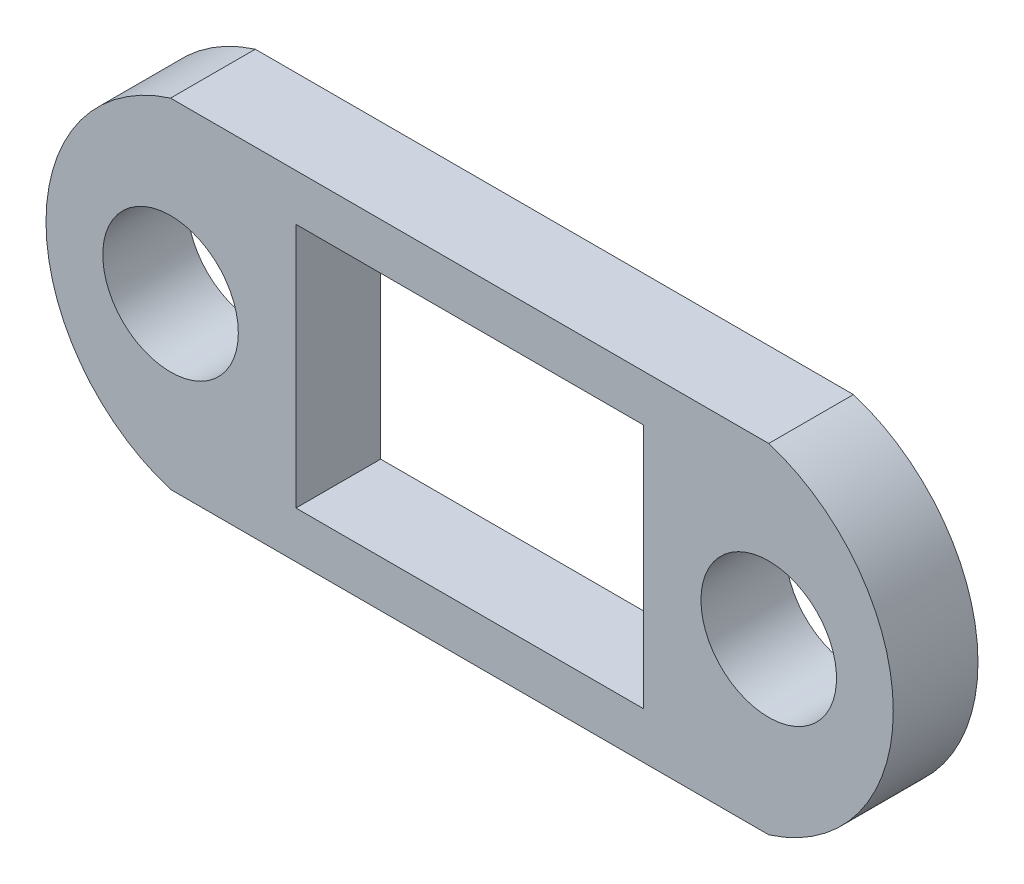
from build123d import *

# Parameters (mm, degrees)
SKETCH2_R           = 2
BOSS_EXTRUDE1_DEPTH = 2.5


with BuildPart() as part:
    # Sketch2 → Boss-Extrude1 (new body)
    with BuildSketch(Plane.XY):
        with BuildLine():
            Line((-8.825, 5.0000164), (8.825, 5.0000164))
            ThreePointArc((8.825, 5.0000164), (12.499924895, -2.3221e-05), (8.825, -5.000062843))
            Line((8.825, -5.000062843), (-8.825, -5.000062843))
            ThreePointArc((-8.825, -5.000062843), (-12.499924895, -2.3221e-05), (-8.825, 5.0000164))
        make_face()
        with Locations((-8.825, -2.3221e-05)):
            Circle(SKETCH2_R, mode=Mode.SUBTRACT)
        with Locations(Location((8.825, -2.3221e-05, 0), (0, 0, 180))):
            Circle(SKETCH2_R, mode=Mode.SUBTRACT)
        Polygon((-5.125, -2.725), (-5.125, 2.725), (-5.125, 3.625), (-3.085, 3.625), (3.085, 3.625), (5.125, 3.625), (5.125, 2.725), (5.125, -2.725), (5.125, -3.625), (3.085, -3.625), (-3.085, -3.625), (-5.125, -3.625), align=None, mode=Mode.SUBTRACT)
    extrude(amount=BOSS_EXTRUDE1_DEPTH)


solid = part.part
